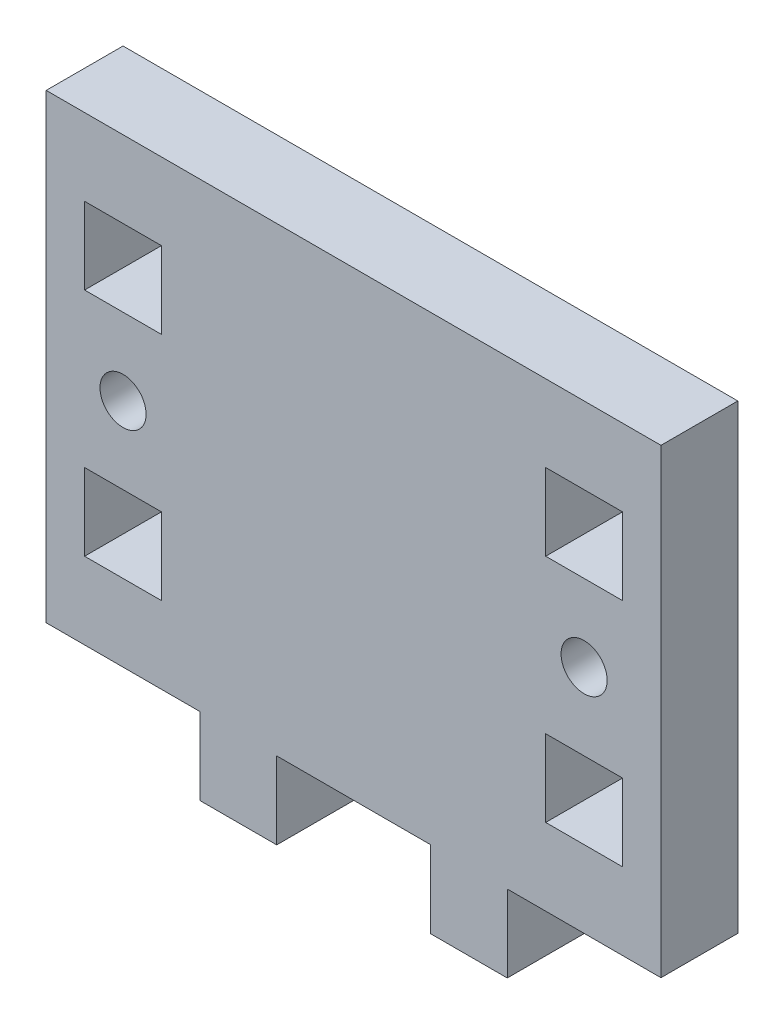
from build123d import *

# Parameters (mm, degrees)
SKETCH1_R           = 1.5
SKETCH1_W           = 5
SKETCH1_H           = 5
BOSS_EXTRUDE1_DEPTH = 5


with BuildPart() as part:
    # Sketch1 → Boss-Extrude1 (new body)
    with BuildSketch(Plane.XY):
        Polygon((0, 0), (0, 5.015390442), (-10, 5.015390442), (-10, 0), (-15, 0), (-15, 5.015390442), (-25, 5.015390442), (-25, 35.015390442), (15, 35.015390442), (15, 5.015390442), (5, 5.015390442), (5, 0), align=None)
        with Locations((-20, 20.015390442)):
            Circle(SKETCH1_R, mode=Mode.SUBTRACT)
        with Locations((10, 20.015390442)):
            Circle(SKETCH1_R, mode=Mode.SUBTRACT)
        with Locations((-20, 12.515390442)):
            Rectangle(SKETCH1_W, SKETCH1_H, mode=Mode.SUBTRACT)
        with Locations((-20, 27.515390442)):
            Rectangle(SKETCH1_W, SKETCH1_H, mode=Mode.SUBTRACT)
        with Locations((10, 12.515390442)):
            Rectangle(SKETCH1_W, SKETCH1_H, mode=Mode.SUBTRACT)
        with Locations((10, 27.515390442)):
            Rectangle(SKETCH1_W, SKETCH1_H, mode=Mode.SUBTRACT)
    extrude(amount=BOSS_EXTRUDE1_DEPTH)


solid = part.part
